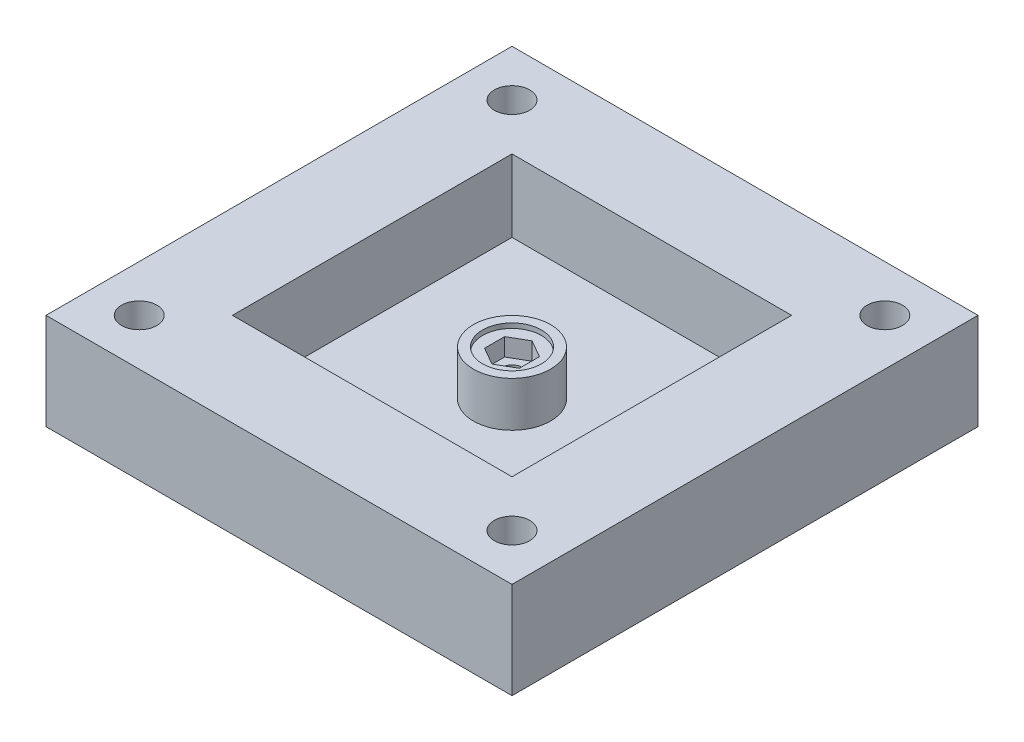
from build123d import *

# Parameters (mm, degrees)
SKETCH1_W           = 145
SKETCH1_H           = 145
BOSS_EXTRUDE1_DEPTH = 30
SKETCH2_W           = 87
SKETCH2_H           = 87
CUT_EXTRUDE1_DEPTH  = 22.5
SKETCH3_R           = 12
BOSS_EXTRUDE2_DEPTH = 14
CUT_EXTRUDE2_DEPTH  = 7
SKETCH5_R           = 5.5
CUT_EXTRUDE3_DEPTH  = 15
CUT_EXTRUDE4_REACH  = 105.695
SKETCH6_R           = 3.05
SKETCH7_R           = 9.15
CUT_EXTRUDE5_DEPTH  = 1.5


with BuildPart() as part:
    # Sketch1 → Boss-Extrude1 (new body)
    with BuildSketch(Plane(origin=(0, 0, 0), x_dir=(1, 0, 0), z_dir=(0, 1, 0))):
        Rectangle(SKETCH1_W, SKETCH1_H)
    extrude(amount=BOSS_EXTRUDE1_DEPTH)

    # Sketch2 → Cut-Extrude1 (cut)
    with BuildSketch(Plane(origin=(0, 30, 0), x_dir=(1, 0, 0), z_dir=(0, 1, 0))):
        Rectangle(SKETCH2_W, SKETCH2_H)
    extrude(amount=-CUT_EXTRUDE1_DEPTH, mode=Mode.SUBTRACT)

    # Sketch3 → Boss-Extrude2 (add)
    with BuildSketch(Plane(origin=(0, 7.5, 0), x_dir=(1, 0, 0), z_dir=(0, 1, 0))):
        with Locations(Location((0, 0, 0), (0, 0, 90))):
            Circle(SKETCH3_R)
    extrude(amount=BOSS_EXTRUDE2_DEPTH)

    # Sketch4 → Cut-Extrude2 (cut)
    with BuildSketch(Plane(origin=(0, 21.5, 0), x_dir=(1, 0, 0), z_dir=(0, 1, 0))):
        Polygon((0, 6.25), (-5.412658774, 3.125), (-5.412658774, -3.125), (0, -6.25), (5.412658774, -3.125), (5.412658774, 3.125), align=None)
    extrude(amount=-CUT_EXTRUDE2_DEPTH, mode=Mode.SUBTRACT)

    # Sketch5 → Cut-Extrude3 (cut)
    with BuildSketch(Plane(origin=(0, 30, 0), x_dir=(1, 0, 0), z_dir=(0, 1, 0))):
        with Locations(Location((-58, 58, 0), (0, 0, 270))):
            Circle(SKETCH5_R)
        with Locations(Location((58, 58, 0), (0, 0, 90))):
            Circle(SKETCH5_R)
        with Locations(Location((58, -58, 0), (0, 0, 270))):
            Circle(SKETCH5_R)
        with Locations(Location((-58, -58, 0), (0, 0, 90))):
            Circle(SKETCH5_R)
    extrude(amount=-CUT_EXTRUDE3_DEPTH, mode=Mode.SUBTRACT)

    # Sketch6 → Cut-Extrude4 (cut, up to next)
    with BuildSketch(Plane(origin=(0, 14.5, 0), x_dir=(1, 0, 0), z_dir=(0, 1, 0)), mode=Mode.PRIVATE) as cut_extrude4_sk1:
        with Locations(Location((0, 0, 0), (0, 0, 270))):
            Circle(SKETCH6_R)
    cut_extrude4_tool1 = extrude(cut_extrude4_sk1.sketch, amount=-CUT_EXTRUDE4_REACH, mode=Mode.PRIVATE) & part.part
    add(cut_extrude4_tool1.solids().sort_by_distance((0, 14.5, 0))[0], mode=Mode.SUBTRACT)

    # Sketch7 → Cut-Extrude5 (cut)
    with BuildSketch(Plane(origin=(0, 21.5, 0), x_dir=(1, 0, 0), z_dir=(0, 1, 0))):
        with Locations(Location((0, 0, 0), (0, 0, 270))):
            Circle(SKETCH7_R)
    extrude(amount=-CUT_EXTRUDE5_DEPTH, mode=Mode.SUBTRACT)


solid = part.part
